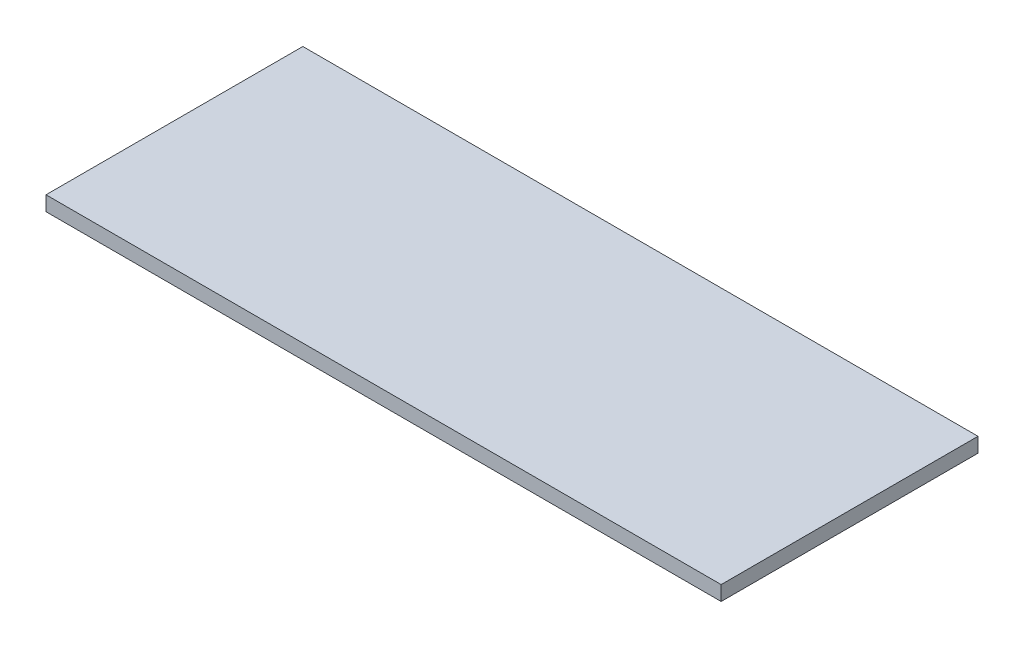
from build123d import *

# Parameters (mm, degrees)
SKETCH1_W           = 460
SKETCH1_H           = 175
BOSS_EXTRUDE1_DEPTH = 10


with BuildPart() as part:
    # Sketch1 → Boss-Extrude1 (new body)
    with BuildSketch(Plane(origin=(0, 0, 0), x_dir=(1, 0, 0), z_dir=(0, 1, 0))):
        with Locations((230, 87.5)):
            Rectangle(SKETCH1_W, SKETCH1_H)
    extrude(amount=BOSS_EXTRUDE1_DEPTH)


solid = part.part
